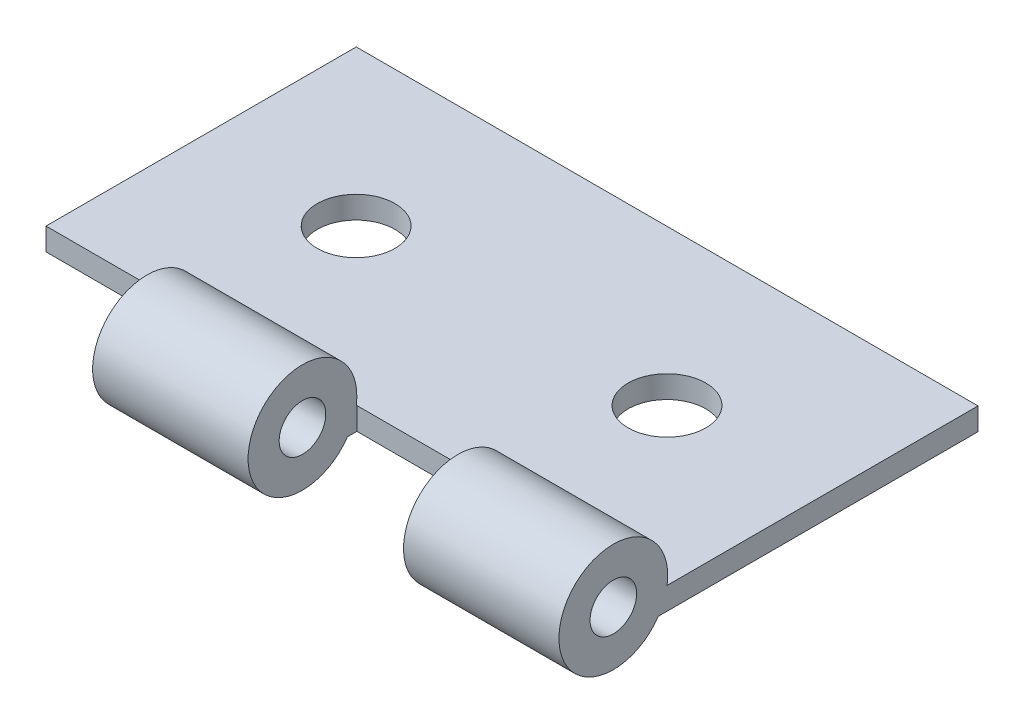
from build123d import *

# Parameters (mm, degrees)
SKETCH4_R           = 1.905
BOSS_EXTRUDE2_DEPTH = 50.8
SKETCH5_W           = 12.7
SKETCH5_H           = 8.89
CUT_EXTRUDE2_DEPTH  = 62.885856388
SKETCH6_R           = 3.175
CUT_EXTRUDE3_DEPTH  = 60.114292576


with BuildPart() as part:
    # Sketch4 → Boss-Extrude2 (new body)
    with BuildSketch(Plane(origin=(0, 0, 0), x_dir=(0, 0, -1), z_dir=(1, 0, 0))):
        with BuildLine():
            Line((29.794065187, -0.670981472), (4.394065187, -0.670981472))
            ThreePointArc((4.394065187, -0.670981472), (-4.137088067, 1.625585225), (3.675475152, -2.499781472))
            Line((3.675475152, -2.499781472), (29.794065187, -2.499781472))
            Line((29.794065187, -2.499781472), (29.794065187, -0.670981472))
        make_face()
        Circle(SKETCH4_R, mode=Mode.SUBTRACT)
    extrude(amount=BOSS_EXTRUDE2_DEPTH)

    # Sketch5 → Cut-Extrude2 (cut, through all)
    with BuildSketch(Plane(origin=(0, 14.569018528, 0), x_dir=(1, 0, 0), z_dir=(0, 1, 0))):
        with Locations((6.35, 0)):
            Rectangle(SKETCH5_W, SKETCH5_H)
        with Locations((31.75, 0)):
            Rectangle(SKETCH5_W, SKETCH5_H)
    extrude(amount=-CUT_EXTRUDE2_DEPTH, mode=Mode.SUBTRACT)

    # Sketch6 → Cut-Extrude3 (cut, through all)
    with BuildSketch(Plane(origin=(0, -0.670981472, 0), x_dir=(1, 0, 0), z_dir=(0, 1, 0))):
        with Locations(Location((12.663329801, 17.119532593, 0), (0, 0, 270))):
            Circle(SKETCH6_R)
        with Locations(Location((38.063329801, 17.119532593, 0), (0, 0, 270))):
            Circle(SKETCH6_R)
    extrude(amount=-CUT_EXTRUDE3_DEPTH, mode=Mode.SUBTRACT)


solid = part.part
